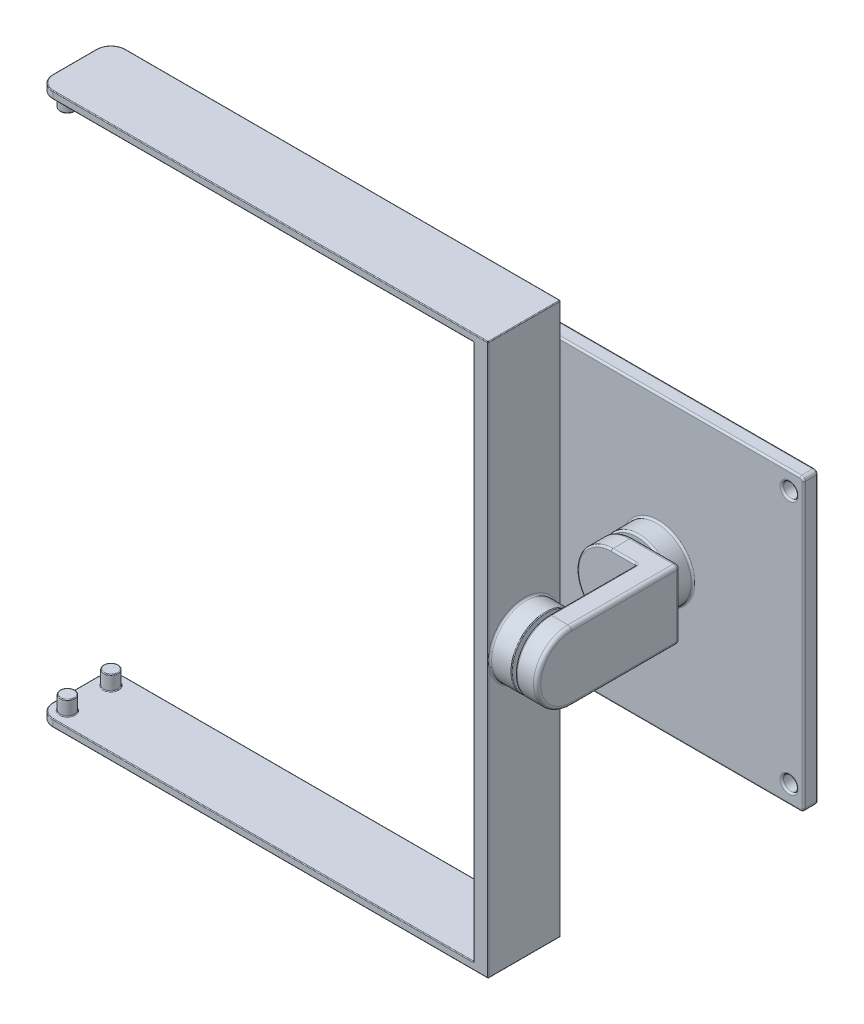
from build123d import *

# Parameters (mm, degrees)
BOSS_EXTRUDE1_DEPTH  = 10
BOSS_EXTRUDE2_START  = -37
SKETCH2_R            = 1
BOSS_EXTRUDE2_DEPTH  = 2
BOSS_EXTRUDE3_START  = 35
SKETCH2_2_R          = 1
BOSS_EXTRUDE3_DEPTH  = 2
FILLET1_R            = 2
FILLET2_R            = 0.1
SKETCH4_R            = 4.75
BOSS_EXTRUDE4_DEPTH  = 3
FILLET3_R            = 0.1
SKETCH5_R            = 3
BOSS_EXTRUDE5_DEPTH  = 0.5
SKETCH6_R            = 4.75
BOSS_EXTRUDE6_DEPTH  = 3
SKETCH7_W            = 15
SKETCH7_H            = 9.5
BOSS_EXTRUDE7_DEPTH  = 3
BOSS_EXTRUDE8_DEPTH  = 3
SKETCH10_R           = 3
BOSS_EXTRUDE9_DEPTH  = 0.5
BOSS_EXTRUDE10_START = 3
SKETCH11_R           = 4.75
BOSS_EXTRUDE10_DEPTH = 3
SKETCH12_W           = 40
SKETCH12_H           = 40
BOSS_EXTRUDE11_DEPTH = 2
FILLET4_R            = 0.5
CUT_EXTRUDE1_REACH   = 77.46
SKETCH13_R           = 1
FILLET5_R            = 0.5
FILLET6_R            = 0.25


with BuildPart() as part:
    # Sketch1 → Boss-Extrude1 (new body)
    with BuildSketch(Plane.XY):
        Polygon((0, -37), (0, 37), (-60, 37), (-60, 38), (2, 38), (2, -38), (-60, -38), (-60, -37), align=None)
    extrude(amount=BOSS_EXTRUDE1_DEPTH)

    # Sketch2 → Boss-Extrude2 (add)
    with BuildSketch(Plane(origin=(0, 0, 0), x_dir=(1, 0, 0), z_dir=(0, 1, 0)).offset(BOSS_EXTRUDE2_START)):
        with Locations(Location((-58, -2, 0), (0, 0, 90))):
            Circle(SKETCH2_R)
        with Locations(Location((-58, -8, 0), (0, 0, 90))):
            Circle(SKETCH2_R)
    extrude(amount=BOSS_EXTRUDE2_DEPTH)

    # Sketch2<2> → Boss-Extrude3 (add)
    with BuildSketch(Plane(origin=(0, 0, 0), x_dir=(1, 0, 0), z_dir=(0, 1, 0)).offset(BOSS_EXTRUDE3_START)):
        with Locations(Location((-58, -2, 0), (0, 0, 90))):
            Circle(SKETCH2_2_R)
        with Locations(Location((-58, -8, 0), (0, 0, 90))):
            Circle(SKETCH2_2_R)
    extrude(amount=BOSS_EXTRUDE3_DEPTH)

    # Fillet1
    fillet1_edges = [part.edges().sort_by_distance(p)[0] for p in [
        (-60, 37.5, 0),
        (-60, -37.5, 10),
        (-60, 37.5, 10),
        (-60, -37.5, 0),
    ]]
    fillet(fillet1_edges, radius=FILLET1_R)

    # Fillet2
    fillet2_edges = [part.edges().sort_by_distance(p)[0] for p in [
        (0, 0, 10),
        (-29, -37, 10),
        (2, 38, 5),
        (2, -38, 5),
        (0, -37, 5),
        (0, 37, 5),
        (2, 0, 10),
        (-58, -35, 3),
        (-58, -37, 3),
        (-28, 38, 10),
        (-58, -35, 9),
        (-58, -37, 9),
        (-58, 35, 3),
        (-58, 37, 3),
        (-58, 35, 9),
        (-58, 37, 9),
        (-29, 37, 10),
        (-28, -38, 10),
        (-28, -38, 0),
        (-60, -38, 5),
        (-59.414213562, -38, 0.585786438),
        (-59.414213562, -38, 9.414213562),
        (-60, -37, 5),
        (-59.414213562, -37, 0.585786438),
        (-59.414213562, -37, 9.414213562),
        (-29, 37, 0),
        (-60, 37, 5),
        (-59.414213562, 37, 0.585786438),
        (-59.414213562, 37, 9.414213562),
        (-60, 38, 5),
        (-59.414213562, 38, 0.585786438),
        (-59.414213562, 38, 9.414213562),
        (-28, 38, 0),
        (2, 0, 0),
        (-29, -37, 0),
        (0, 0, 0),
    ]]
    fillet(fillet2_edges, radius=FILLET2_R)

    # Sketch4 → Boss-Extrude4 (add)
    with BuildSketch(Plane(origin=(2, 0, 0), x_dir=(0, 0, -1), z_dir=(1, 0, 0))):
        with Locations(Location((-5, 0, 0), (0, 0, 270))):
            Circle(SKETCH4_R)
    extrude(amount=BOSS_EXTRUDE4_DEPTH)

    # Fillet3
    fillet3_edges = [part.edges().sort_by_distance(p)[0] for p in [
        (5, 4.75, 5),
    ]]
    fillet(fillet3_edges, radius=FILLET3_R)

    # Sketch5 → Boss-Extrude5 (add)
    with BuildSketch(Plane(origin=(5, 0, 0), x_dir=(0, 0, -1), z_dir=(1, 0, 0))):
        with Locations(Location((-5, 0, 0), (0, 0, 90))):
            Circle(SKETCH5_R)
    extrude(amount=BOSS_EXTRUDE5_DEPTH)

    # Sketch6 → Boss-Extrude6 (add)
    with BuildSketch(Plane(origin=(5.5, 0, 0), x_dir=(0, 0, -1), z_dir=(1, 0, 0))):
        with Locations(Location((-5, 0, 0), (0, 0, 270))):
            Circle(SKETCH6_R)
    extrude(amount=BOSS_EXTRUDE6_DEPTH)

    # Sketch7 → Boss-Extrude7 (add)
    with BuildSketch(Plane(origin=(8.5, 0, 0), x_dir=(0, 0, -1), z_dir=(1, 0, 0))):
        with Locations((2.5, 0)):
            Rectangle(SKETCH7_W, SKETCH7_H)
    extrude(amount=-BOSS_EXTRUDE7_DEPTH)

    # Sketch9 → Boss-Extrude8 (add)
    with BuildSketch(Plane(origin=(0, 0, -10), x_dir=(-1, 0, 0), z_dir=(0, 0, -1))):
        with BuildLine():
            Line((-8.5, 4.75), (-2, 4.75))
            ThreePointArc((-2, 4.75), (2.75, 0), (-2, -4.75))
            Line((-2, -4.75), (-8.5, -4.75))
            Line((-8.5, -4.75), (-8.5, 4.75))
        make_face()
    extrude(amount=-BOSS_EXTRUDE8_DEPTH)

    # Sketch10 → Boss-Extrude9 (add)
    with BuildSketch(Plane(origin=(0, 0, -10), x_dir=(-1, 0, 0), z_dir=(0, 0, -1))):
        with Locations((-2, 0)):
            Circle(SKETCH10_R)
    extrude(amount=BOSS_EXTRUDE9_DEPTH)

    # Sketch11 → Boss-Extrude10 (add)
    with BuildSketch(Plane(origin=(0, 0, -10.5), x_dir=(-1, 0, 0), z_dir=(0, 0, -1)).offset(BOSS_EXTRUDE10_START)):
        with Locations((-2, 0)):
            Circle(SKETCH11_R)
    extrude(amount=-BOSS_EXTRUDE10_DEPTH)

    # Sketch12 → Boss-Extrude11 (add)
    with BuildSketch(Plane(origin=(0, 0, -13.5), x_dir=(-1, 0, 0), z_dir=(0, 0, -1))):
        with Locations((-2, 0)):
            Rectangle(SKETCH12_W, SKETCH12_H)
    extrude(amount=BOSS_EXTRUDE11_DEPTH)

    # Fillet4
    fillet4_edges = [part.edges().sort_by_distance(p)[0] for p in [
        (-18, -20, -14.5),
        (-18, 20, -14.5),
        (22, 20, -14.5),
        (22, -20, -14.5),
    ]]
    fillet(fillet4_edges, radius=FILLET4_R)

    # Sketch13 → Cut-Extrude1 (cut, up to next)
    with BuildSketch(Plane(origin=(0, 0, -15.5), x_dir=(-1, 0, 0), z_dir=(0, 0, -1)), mode=Mode.PRIVATE) as cut_extrude1_sk1:
        with Locations((16, 17.5)):
            Circle(SKETCH13_R)
    cut_extrude1_tool1 = extrude(cut_extrude1_sk1.sketch, amount=-CUT_EXTRUDE1_REACH, mode=Mode.PRIVATE) & part.part
    # Sketch13 → Cut-Extrude1 (cut, up to next)
    with BuildSketch(Plane(origin=(0, 0, -15.5), x_dir=(-1, 0, 0), z_dir=(0, 0, -1)), mode=Mode.PRIVATE) as cut_extrude1_sk2:
        with Locations((-20, 17.5)):
            Circle(SKETCH13_R)
    cut_extrude1_tool2 = extrude(cut_extrude1_sk2.sketch, amount=-CUT_EXTRUDE1_REACH, mode=Mode.PRIVATE) & part.part
    # Sketch13 → Cut-Extrude1 (cut, up to next)
    with BuildSketch(Plane(origin=(0, 0, -15.5), x_dir=(-1, 0, 0), z_dir=(0, 0, -1)), mode=Mode.PRIVATE) as cut_extrude1_sk3:
        with Locations((-20, -17.5)):
            Circle(SKETCH13_R)
    cut_extrude1_tool3 = extrude(cut_extrude1_sk3.sketch, amount=-CUT_EXTRUDE1_REACH, mode=Mode.PRIVATE) & part.part
    # Sketch13 → Cut-Extrude1 (cut, up to next)
    with BuildSketch(Plane(origin=(0, 0, -15.5), x_dir=(-1, 0, 0), z_dir=(0, 0, -1)), mode=Mode.PRIVATE) as cut_extrude1_sk4:
        with Locations((16, -17.5)):
            Circle(SKETCH13_R)
    cut_extrude1_tool4 = extrude(cut_extrude1_sk4.sketch, amount=-CUT_EXTRUDE1_REACH, mode=Mode.PRIVATE) & part.part
    add(cut_extrude1_tool1.solids().sort_by_distance((-16, 17.5, -15.5))[0], mode=Mode.SUBTRACT)
    add(cut_extrude1_tool2.solids().sort_by_distance((20, 17.5, -15.5))[0], mode=Mode.SUBTRACT)
    add(cut_extrude1_tool3.solids().sort_by_distance((20, -17.5, -15.5))[0], mode=Mode.SUBTRACT)
    add(cut_extrude1_tool4.solids().sort_by_distance((-16, -17.5, -15.5))[0], mode=Mode.SUBTRACT)

    # Fillet5
    fillet5_edges = [part.edges().sort_by_distance(p)[0] for p in [
        (8.5, 0, 9.75),
        (5.25, 4.75, -10),
        (5.25, -4.75, -10),
        (8.5, -4.75, -2.5),
        (8.5, 0, -10),
        (8.5, 4.75, -2.5),
        (-2.75, 0, -10),
    ]]
    fillet(fillet5_edges, radius=FILLET5_R)

    # Fillet6
    fillet6_edges = [part.edges().sort_by_distance(p)[0] for p in [
        (2, 4.75, 5),
        (5.5, 0, 9.75),
        (5.5, 4.75, -1),
        (5.5, -4.75, -1),
        (3.75, 4.75, -7),
        (3.75, -4.75, -7),
        (5.5, 0, -7),
        (-2.75, 0, -7),
        (6.75, 0, -10.5),
        (6.75, 0, -13.5),
        (2, -20, -13.5),
        (2, -20, -15.5),
        (-18, 0, -13.5),
        (22, 0, -13.5),
        (2, 20, -13.5),
        (-17.853553391, 19.853553391, -13.5),
        (21.853553391, 19.853553391, -13.5),
        (-17.853553391, -19.853553391, -13.5),
        (21.853553391, -19.853553391, -13.5),
        (22, 0, -15.5),
        (-18, 0, -15.5),
        (2, 20, -15.5),
        (-17.853553391, 19.853553391, -15.5),
        (21.853553391, 19.853553391, -15.5),
        (-17.853553391, -19.853553391, -15.5),
        (21.853553391, -19.853553391, -15.5),
        (-15, -17.5, -15.5),
        (-15, -17.5, -13.5),
        (21, 17.5, -15.5),
        (21, 17.5, -13.5),
        (21, -17.5, -15.5),
        (21, -17.5, -13.5),
        (-15, 17.5, -15.5),
        (-15, 17.5, -13.5),
    ]]
    fillet(fillet6_edges, radius=FILLET6_R)


solid = part.part
